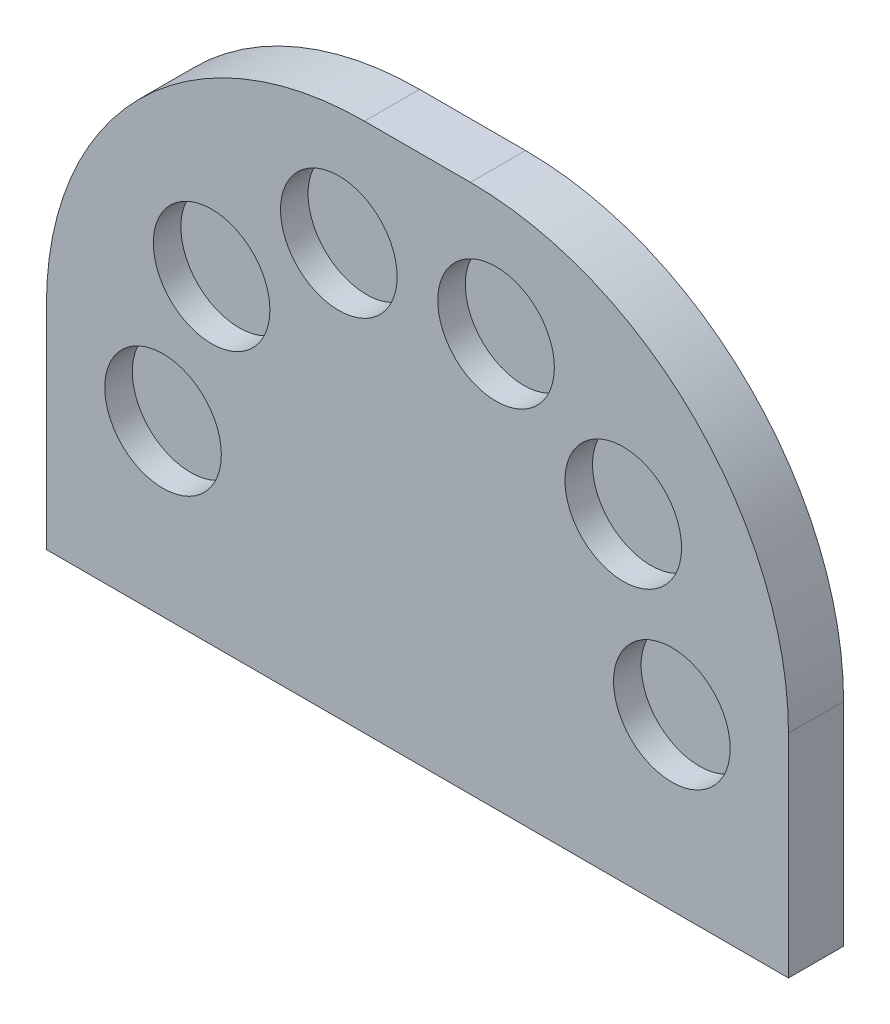
from build123d import *

# Parameters (mm, degrees)
SKETCH1_W                 = 350
SKETCH1_H                 = 250
BOSS_EXTRUDE1_DEPTH       = 26
SKETCH2_W                 = 1
SKETCH2_H                 = 40
BOSS_EXTRUDE2_DEPTH       = 50
M48_CLEARANCE_HOLE1_D     = 55
M48_CLEARANCE_HOLE1_DEPTH = 13
FILLET1_R                 = 150


with BuildPart() as part:
    # Sketch1 → Boss-Extrude1 (new body)
    with BuildSketch(Plane.XY.offset(26)):
        with Locations((175, 125)):
            Rectangle(SKETCH1_W, SKETCH1_H)
    extrude(amount=-BOSS_EXTRUDE1_DEPTH)

    # Sketch2 → Boss-Extrude2 (add)
    with BuildSketch(Plane(origin=(0, 0, 0), x_dir=(-1, 0, 0), z_dir=(0, 0, -1))):
        with Locations((-279.5, 30)):
            Rectangle(SKETCH2_W, SKETCH2_H)
    extrude(amount=BOSS_EXTRUDE2_DEPTH)

    # M48 Clearance Hole1
    with Locations(Plane.XY.offset(26)):
        with Locations((55, 80), (212.082039325, 194.126781955), (272.082039325, 150.534230275), (295, 80), (137.917960675, 194.126781955), (77.917960675, 150.534230275)):
            Hole(M48_CLEARANCE_HOLE1_D / 2, depth=M48_CLEARANCE_HOLE1_DEPTH)

    # Fillet1
    fillet1_edges = [part.edges().sort_by_distance(p)[0] for p in [
        (0, 250, 13),
        (350, 250, 13),
    ]]
    fillet(fillet1_edges, radius=FILLET1_R)


solid = part.part
